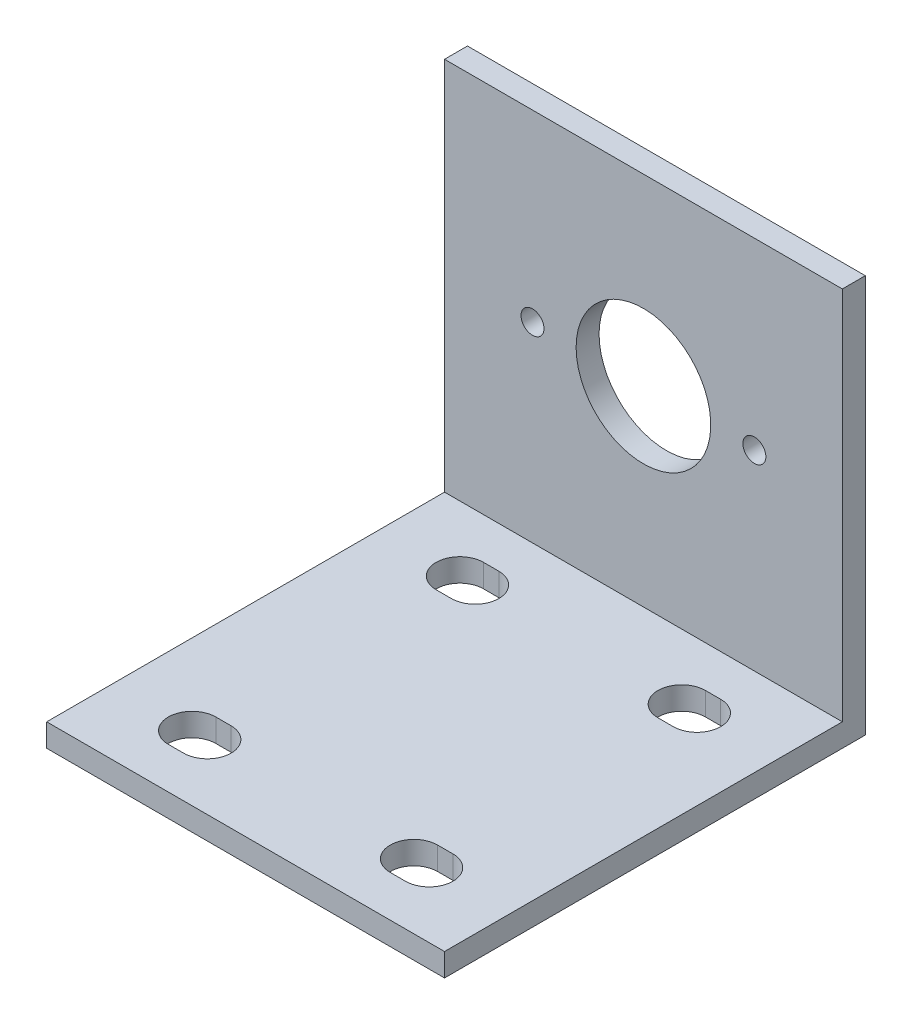
from build123d import *

# Parameters (mm, degrees)
SKETCH_1_W      = 52
SKETCH_1_H      = 52
EXTRUDE_1_DEPTH = 3
SKETCH_2_W      = 52
SKETCH_2_H      = 52
SKETCH_2_R      = 1.5
SKETCH_2_R_2    = 8.8
EXTRUDE_2_DEPTH = 3


with BuildPart() as part:
    # 草圖1 → 填料-伸長1 (new body)
    with BuildSketch(Plane(origin=(0, 0, 0), x_dir=(1, 0, 0), z_dir=(0, 1, 0))):
        Rectangle(SKETCH_1_W, SKETCH_1_H)
        with BuildLine():
            Line((-15.5, 20.6), (-13.5, 20.6))
            ThreePointArc((-13.5, 20.6), (-10.4, 17.5), (-13.5, 14.4))
            Line((-13.5, 14.4), (-15.5, 14.4))
            ThreePointArc((-15.5, 14.4), (-18.6, 17.5), (-15.5, 20.6))
        make_face(mode=Mode.SUBTRACT)
        with BuildLine():
            Line((15.5, 20.6), (13.5, 20.6))
            ThreePointArc((13.5, 20.6), (10.4, 17.5), (13.5, 14.4))
            Line((13.5, 14.4), (15.5, 14.4))
            ThreePointArc((15.5, 14.4), (18.6, 17.5), (15.5, 20.6))
        make_face(mode=Mode.SUBTRACT)
        with BuildLine():
            Line((15.5, -20.6), (13.5, -20.6))
            ThreePointArc((13.5, -20.6), (10.4, -17.5), (13.5, -14.4))
            Line((13.5, -14.4), (15.5, -14.4))
            ThreePointArc((15.5, -14.4), (18.6, -17.5), (15.5, -20.6))
        make_face(mode=Mode.SUBTRACT)
        with BuildLine():
            Line((-15.5, -20.6), (-13.5, -20.6))
            ThreePointArc((-13.5, -20.6), (-10.4, -17.5), (-13.5, -14.4))
            Line((-13.5, -14.4), (-15.5, -14.4))
            ThreePointArc((-15.5, -14.4), (-18.6, -17.5), (-15.5, -20.6))
        make_face(mode=Mode.SUBTRACT)
    extrude(amount=EXTRUDE_1_DEPTH)

    # 草圖2 → 填料-伸長2 (add)
    with BuildSketch(Plane(origin=(0, 0, -26), x_dir=(-1, 0, 0), z_dir=(0, 0, -1))):
        with Locations((0, 26)):
            Rectangle(SKETCH_2_W, SKETCH_2_H)
        with Locations((-14.5, 28)):
            Circle(SKETCH_2_R, mode=Mode.SUBTRACT)
        with Locations((14.5, 28)):
            Circle(SKETCH_2_R, mode=Mode.SUBTRACT)
        with Locations((0, 28)):
            Circle(SKETCH_2_R_2, mode=Mode.SUBTRACT)
    extrude(amount=EXTRUDE_2_DEPTH)


solid = part.part
